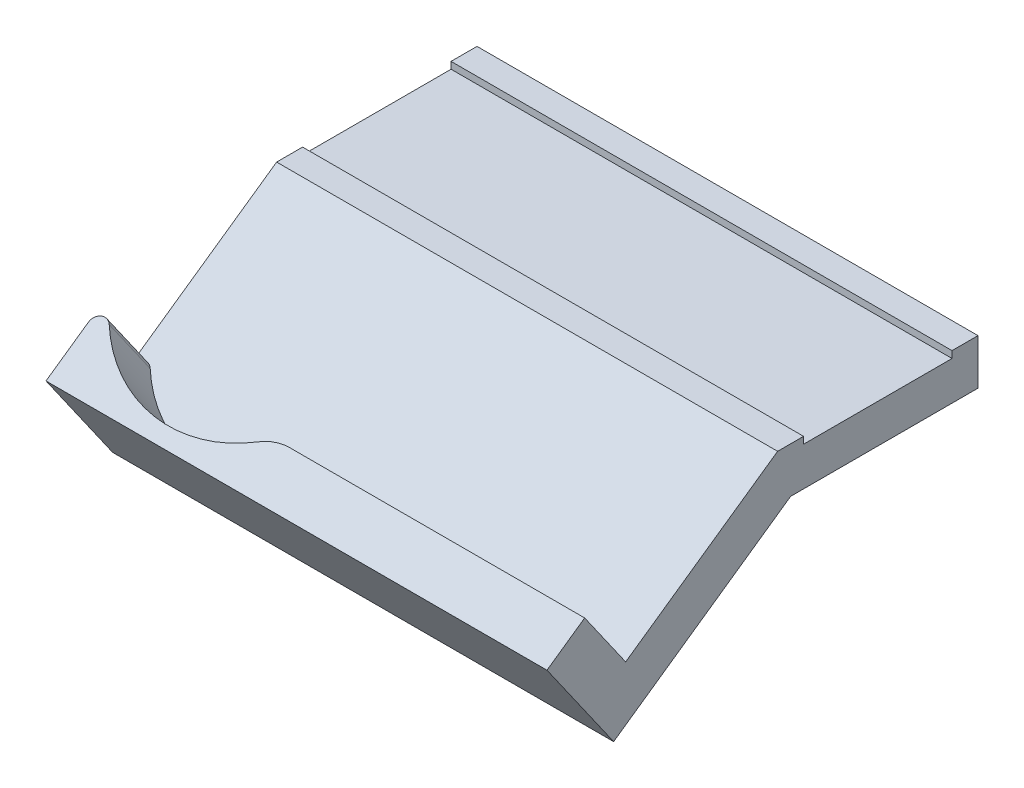
from build123d import *

# Parameters (mm, degrees)
SKETCH1_W           = 55
SKETCH1_H           = 29
BOSS_EXTRUDE1_DEPTH = 50
CUT_EXTRUDE1_DEPTH  = 50
CUT_EXTRUDE2_DEPTH  = 80.787217021
BOSS_EXTRUDE2_REACH = 81.787
SKETCH6_R           = 13.75
CUT_EXTRUDE3_DEPTH  = 80.517499699
CUT_EXTRUDE4_DEPTH  = 80.787217021
SKETCH8_R           = 6
CUT_EXTRUDE5_DEPTH  = 66.758310797
CUT_EXTRUDE6_DEPTH  = 66.758310797
SKETCH10_W          = 55
SKETCH10_H          = 4.5
CUT_EXTRUDE7_DEPTH  = 65.80119658
FILLET5_R           = 1
FILLET6_R           = 5
CUT_EXTRUDE8_DEPTH  = 63.916175013
SKETCH17_W          = 55
SKETCH17_H          = 5
BOSS_EXTRUDE4_DEPTH = 22
BOSS_EXTRUDE5_DEPTH = 55
SKETCH19_W          = 55
SKETCH19_H          = 16.3
CUT_EXTRUDE9_DEPTH  = 0.75
BOSS_EXTRUDE6_DEPTH = 55


with BuildPart() as part:
    # Sketch1 → Boss-Extrude1 (new body)
    with BuildSketch(Plane(origin=(0, 0, 0), x_dir=(1, 0, 0), z_dir=(0, 1, 0))):
        with Locations((27.5, 14.5)):
            Rectangle(SKETCH1_W, SKETCH1_H)
    extrude(amount=BOSS_EXTRUDE1_DEPTH)

    # Sketch4 → Cut-Extrude1 (cut)
    with BuildSketch(Plane(origin=(55, 0, 0), x_dir=(0, 0, -1), z_dir=(1, 0, 0))):
        Polygon((-21.678821818, 46.957602214), (19.278780397, 75.636424032), (47.957602214, 34.678821818), (7, 6), align=None)
    extrude(amount=-CUT_EXTRUDE1_DEPTH, mode=Mode.SUBTRACT)

    # Sketch5 → Cut-Extrude2 (cut, through all)
    with BuildSketch(Plane(origin=(55, 0, 0), x_dir=(0, 0, -1), z_dir=(1, 0, 0))):
        Polygon((-11.427284806, 14.88242211), (-3.235764364, 20.618186473), (2.5, 12.42666603), (-5.691520443, 6.690901667), align=None)
    extrude(amount=-CUT_EXTRUDE2_DEPTH, mode=Mode.SUBTRACT)

    # Sketch12 → Boss-Extrude2 (add, up to next)
    with BuildSketch(Plane(origin=(55, 0, 0), x_dir=(0, 0, -1), z_dir=(1, 0, 0)), mode=Mode.PRIVATE) as boss_extrude2_sk1:
        Polygon((2.5, 12.42666603), (7, 6), (7.819152044, 6.573576436), (3.319152044, 13.000242467), align=None)
    boss_extrude2_tool1 = extrude(boss_extrude2_sk1.sketch, amount=-BOSS_EXTRUDE2_REACH, mode=Mode.PRIVATE) - part.part
    add(boss_extrude2_tool1.solids().sort_by_distance((55, 9.500121, -5.159576))[0])

    # Sketch6 → Cut-Extrude3 (cut, through all)
    with BuildSketch(Plane(origin=(0, 0.737136257, 0.516148364), x_dir=(1, 0, 0), z_dir=(0, 0.8191520442889949, 0.5735764363510418))):
        with Locations((12, 20.623586456)):
            Circle(SKETCH6_R)
    extrude(amount=CUT_EXTRUDE3_DEPTH, mode=Mode.SUBTRACT)

    # Sketch7 → Cut-Extrude4 (cut, through all)
    with BuildSketch(Plane(origin=(55, 0, 0), x_dir=(0, 0, -1), z_dir=(1, 0, 0))):
        Polygon((0, 10.676147185), (6.378851002, 15.142666742), (10.878851002, 8.716000711), (85.085630618, 60.676147185), (25.408423261, 60.676147185), (0, 60.676147185), align=None)
    extrude(amount=-CUT_EXTRUDE4_DEPTH, mode=Mode.SUBTRACT)

    # Sketch8 → Cut-Extrude5 (cut, through all)
    with BuildSketch(Plane(origin=(0, 0, 0), x_dir=(1, 0, 0), z_dir=(0, 1, 0))):
        with Locations((25.75, 30.5)):
            Circle(SKETCH8_R)
    extrude(amount=CUT_EXTRUDE5_DEPTH, mode=Mode.SUBTRACT)

    # Sketch9 → Cut-Extrude6 (cut, through all)
    with BuildSketch(Plane(origin=(55, 0, 0), x_dir=(0, 0, -1), z_dir=(1, 0, 0))):
        Polygon((24.5, 18.253631919), (29, 18.253631919), (29, 21.404565841), align=None)
    extrude(amount=-CUT_EXTRUDE6_DEPTH, mode=Mode.SUBTRACT)

    # Sketch10 → Cut-Extrude7 (cut, through all)
    with BuildSketch(Plane(origin=(0, 0, 0), x_dir=(1, 0, 0), z_dir=(0, 1, 0))):
        with Locations((27.5, 26.75)):
            Rectangle(SKETCH10_W, SKETCH10_H)
    extrude(amount=CUT_EXTRUDE7_DEPTH, mode=Mode.SUBTRACT)

    # Fillet5
    fillet5_edges = [part.edges().sort_by_distance(p)[0] for p in [
        (0, 11.929333726, -8.628851002),
    ]]
    fillet(fillet5_edges, radius=FILLET5_R)

    # Fillet6
    fillet6_edges = [part.edges().sort_by_distance(p)[0] for p in [
        (20.938706199, 9.786909452, -5.569152044),
    ]]
    fillet(fillet6_edges, radius=FILLET6_R)

    # Sketch16 → Cut-Extrude8 (cut, through all)
    with BuildSketch(Plane(origin=(55, 0, 0), x_dir=(0, 0, -1), z_dir=(1, 0, 0))):
        Polygon((24.5, 12.253631919), (7.319077862, 0.223420724), (0, 10.676147185), (0, 0), (24.5, 0), align=None)
    extrude(amount=-CUT_EXTRUDE8_DEPTH, mode=Mode.SUBTRACT)

    # Sketch17 → Boss-Extrude4 (add)
    with BuildSketch(Plane(origin=(0, 0, -24.5), x_dir=(-1, 0, 0), z_dir=(0, 0, -1))):
        with Locations((-27.5, 15.753631919)):
            Rectangle(SKETCH17_W, SKETCH17_H)
    extrude(amount=BOSS_EXTRUDE4_DEPTH)

    # Sketch18 → Boss-Extrude5 (add)
    with BuildSketch(Plane(origin=(55, 0, 0), x_dir=(0, 0, -1), z_dir=(1, 0, 0))):
        Polygon((15.909538931, 6.238526322), (33.06888804, 18.253631919), (24.5, 18.253631919), (13.090461069, 10.264586752), align=None)
    extrude(amount=-BOSS_EXTRUDE5_DEPTH)

    # Sketch19 → Cut-Extrude9 (cut)
    with BuildSketch(Plane(origin=(0, 18.253631919, 0), x_dir=(1, 0, 0), z_dir=(0, 1, 0))):
        with Locations((27.5, 35.5)):
            Rectangle(SKETCH19_W, SKETCH19_H)
    extrude(amount=-CUT_EXTRUDE9_DEPTH, mode=Mode.SUBTRACT)

    # Sketch20 → Boss-Extrude6 (add)
    with BuildSketch(Plane(origin=(55, 0, 0), x_dir=(0, 0, -1), z_dir=(1, 0, 0))):
        Polygon((0, 10.676147185), (-0.819152044, 10.102570748), (6.499925818, -0.350155712), (7.319077862, 0.223420724), align=None)
    extrude(amount=-BOSS_EXTRUDE6_DEPTH)


solid = part.part
